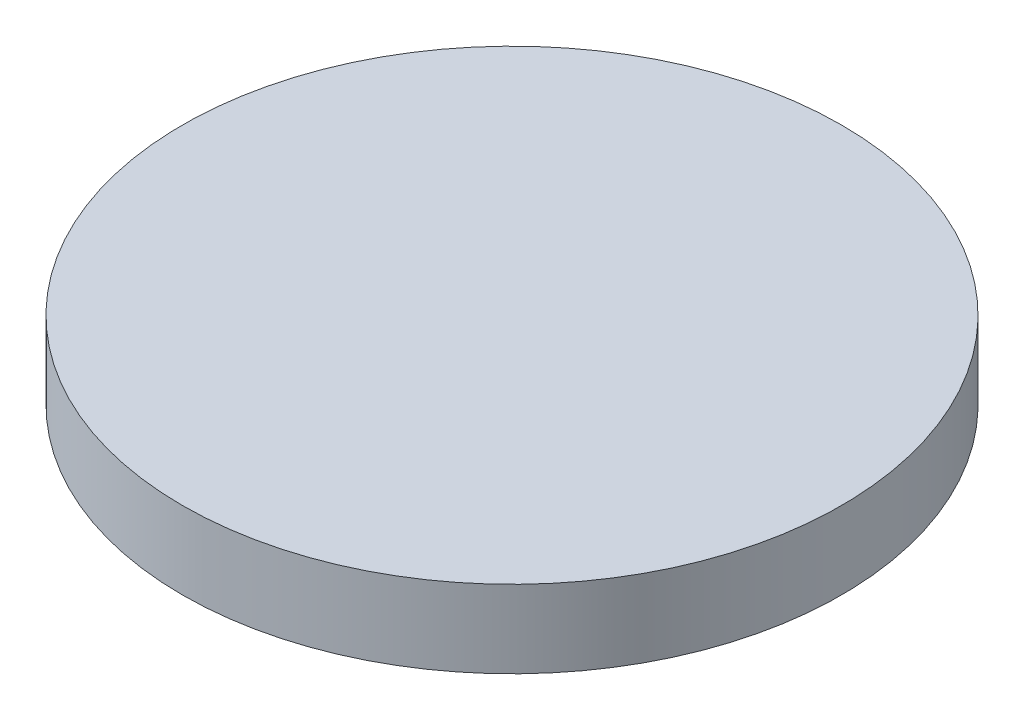
from build123d import *

# Parameters (mm, degrees)
SKETCH1_R           = 21.257795363
BOSS_EXTRUDE1_DEPTH = 5


with BuildPart() as part:
    # Sketch1 → Boss-Extrude1 (new body)
    with BuildSketch(Plane(origin=(0, 0, 0), x_dir=(1, 0, 0), z_dir=(0, 1, 0))):
        with Locations(Location((0, 0, 0), (0, 0, 270))):
            Circle(SKETCH1_R)
    extrude(amount=BOSS_EXTRUDE1_DEPTH)


solid = part.part
